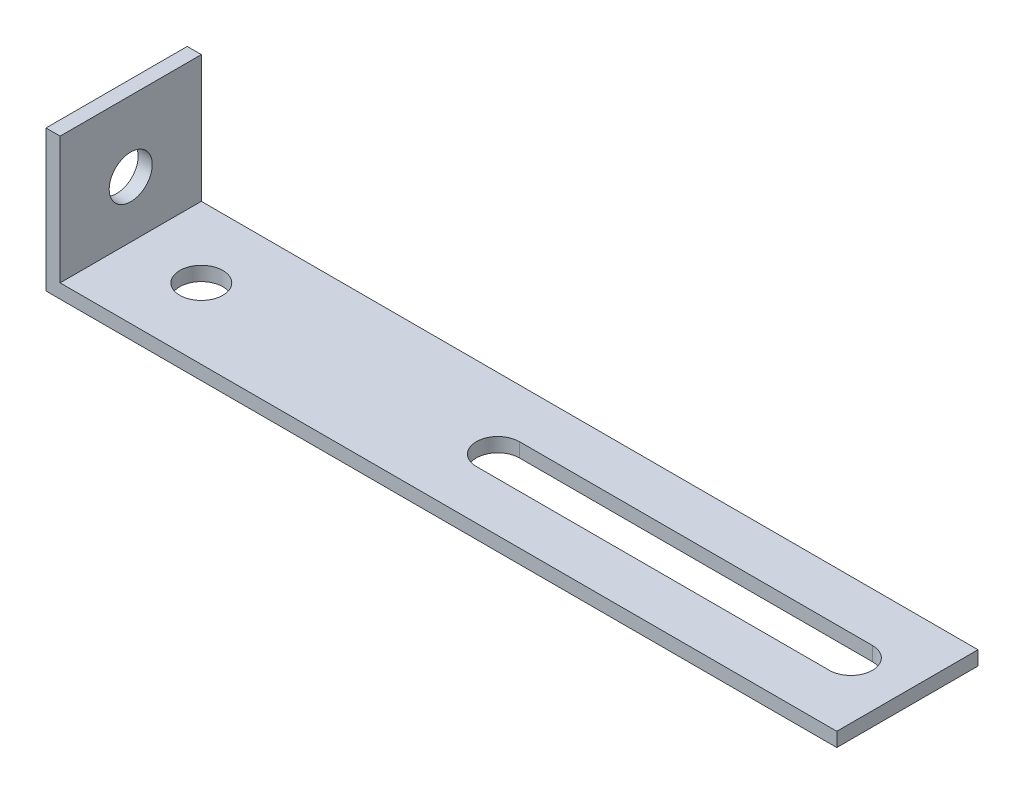
from build123d import *

# Parameters (mm, degrees)
BOSS_EXTRUDE1_DEPTH = 20
SKETCH2_R           = 3.05
CUT_EXTRUDE1_DEPTH  = 116.516232626
SKETCH3_R           = 3.05
CUT_EXTRUDE2_DEPTH  = 116.1868048


with BuildPart() as part:
    # Sketch1 → Boss-Extrude1 (new body)
    with BuildSketch(Plane.XY):
        Polygon((0, 0), (0, 20), (2, 20), (2, 2), (112, 2), (112, 0), align=None)
    extrude(amount=BOSS_EXTRUDE1_DEPTH)

    # Sketch2 → Cut-Extrude1 (cut, through all)
    with BuildSketch(Plane.ZY):
        with Locations((10, 10)):
            Circle(SKETCH2_R)
    extrude(amount=-CUT_EXTRUDE1_DEPTH, mode=Mode.SUBTRACT)

    # Sketch3 → Cut-Extrude2 (cut, through all)
    with BuildSketch(Plane(origin=(0, 2, 0), x_dir=(1, 0, 0), z_dir=(0, 1, 0))):
        with Locations(Location((12, -10, 0), (0, 0, 180))):
            Circle(SKETCH3_R)
        with BuildLine():
            Line((54, -13.05), (104, -13.05))
            ThreePointArc((104, -13.05), (107.05, -10), (104, -6.95))
            Line((104, -6.95), (54, -6.95))
            ThreePointArc((54, -6.95), (50.95, -10), (54, -13.05))
        make_face()
    extrude(amount=-CUT_EXTRUDE2_DEPTH, mode=Mode.SUBTRACT)


solid = part.part
